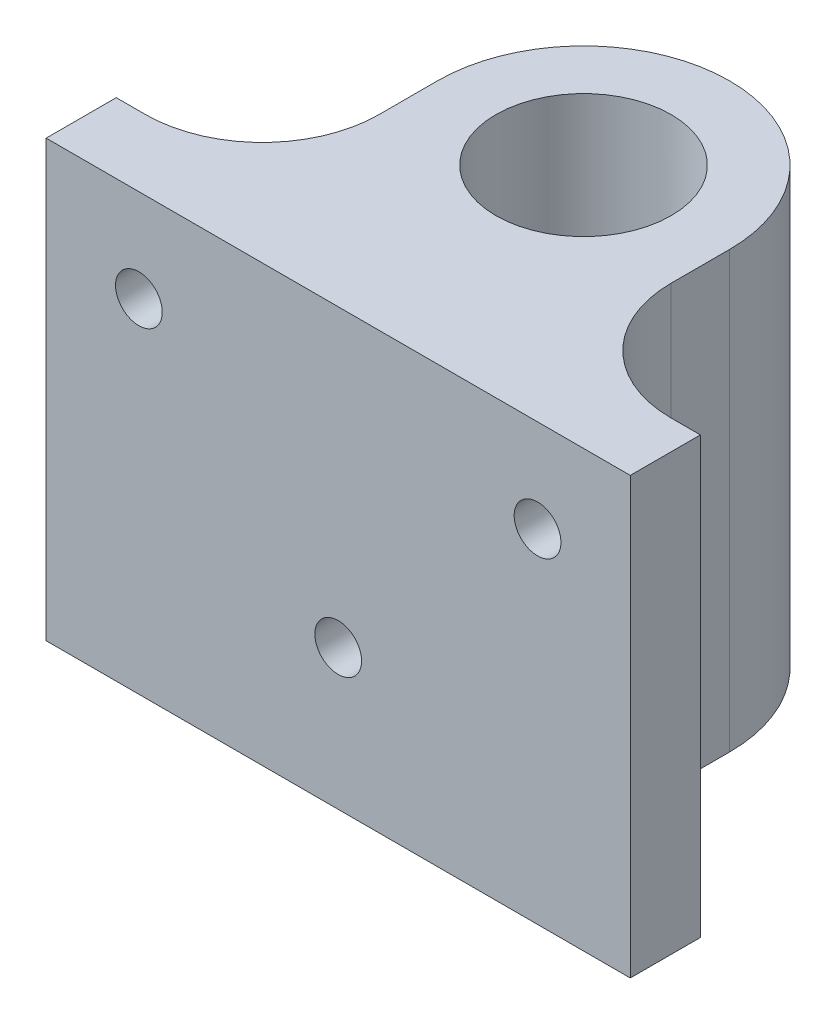
from build123d import *

# Parameters (mm, degrees)
PROFILE_SKETCH1_R                    = 7.5
PROFILE_BOSS_EXTRUDE2_DEPTH          = 37.25987
FASTENINGHOLESKETCH3_R               = 2
FASTENINGHOLECUT_EXTRUDE8_DEPTH      = 56.995963358
LM8UUFASTENINGHOLESKETCH5_R          = 2
LM8UUFASTENINGHOLECUT_EXTRUDE9_DEPTH = 56.995963425


with BuildPart() as part:
    # Profile-Sketch1 → Profile-Boss-Extrude2 (new body)
    with BuildSketch(Plane(origin=(0, 0, 0), x_dir=(1, 0, 0), z_dir=(0, 1, 0))):
        with BuildLine():
            Line((-25, -21), (25, -21))
            Line((25, -21), (25, -15))
            Line((25, -15), (22.5, -15))
            ThreePointArc((22.5, -15), (15.428932188, -12.071067812), (12.5, -5))
            Line((12.5, -5), (12.5, 0))
            ThreePointArc((12.5, 0), (0, 12.5), (-12.5, 0))
            Line((-12.5, 0), (-12.5, -5))
            ThreePointArc((-12.5, -5), (-15.428932188, -12.071067812), (-22.5, -15))
            Line((-22.5, -15), (-25, -15))
            Line((-25, -15), (-25, -21))
        make_face()
        with Locations(Location((0, 0, 0), (0, 0, 270))):
            Circle(PROFILE_SKETCH1_R, mode=Mode.SUBTRACT)
    extrude(amount=PROFILE_BOSS_EXTRUDE2_DEPTH)

    # FasteningHoleSketch3 → FasteningHoleCut-Extrude8 (cut, through all)
    with BuildSketch(Plane.XY.offset(21)):
        with Locations((-17.0625, 29.32237)):
            Circle(FASTENINGHOLESKETCH3_R)
        with Locations((17.0625, 29.32237)):
            Circle(FASTENINGHOLESKETCH3_R)
    extrude(amount=-FASTENINGHOLECUT_EXTRUDE8_DEPTH, mode=Mode.SUBTRACT)

    # LM8UUFasteningHoleSketch5 → LM8UUFasteningHoleCut-Extrude9 (cut, through all)
    with BuildSketch(Plane.XY.offset(21)):
        with Locations((0, 12)):
            Circle(LM8UUFASTENINGHOLESKETCH5_R)
    extrude(amount=-LM8UUFASTENINGHOLECUT_EXTRUDE9_DEPTH, mode=Mode.SUBTRACT)


solid = part.part
